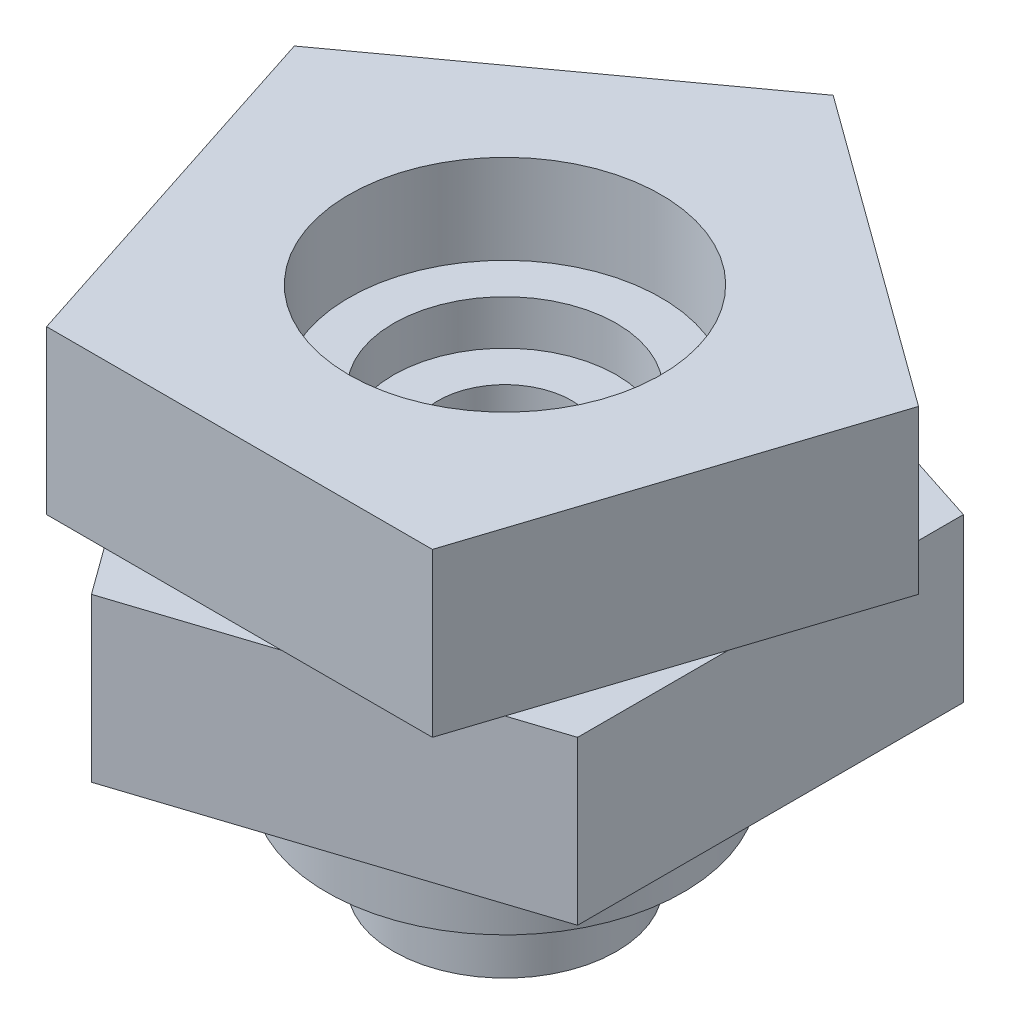
from build123d import *
from build123d.topology import SkipClean

# Parameters (mm, degrees)
EXTRUDE_1_DEPTH     = 3.65
EXTRUDE_2_DEPTH     = 3.65
SKETCH_3_R          = 3.5
CUT_EXTRUDE_1_DEPTH = 2
SKETCH_4_R          = 4
EXTRUDE_3_DEPTH     = 2.5
CUT_EXTRUDE_2_DEPTH = 15.296125349
SKETCH_7_R          = 2.5
CUT_EXTRUDE_3_DEPTH = 1
SKETCH_8_R          = 2.5
EXTRUDE_4_DEPTH     = 1.9


with BuildPart() as part:
    # 草图1 → 凸台-拉伸1 (new body)
    with BuildSketch(Plane(origin=(0, 0, 0), x_dir=(1, 0, 0), z_dir=(0, 1, 0))):
        Polygon((0, 7.36), (-6.99977596, 2.274365079), (-4.326099457, -5.954365079), (4.326099457, -5.954365079), (6.99977596, 2.274365079), align=None)
    extrude(amount=EXTRUDE_1_DEPTH)

    # 草图2 → 凸台-拉伸2 (add)
    with BuildSketch(Plane(origin=(0, 0, 0), x_dir=(1, 0, 0), z_dir=(0, 1, 0))):
        Polygon((-2.274365079, -6.99977596), (5.954365079, -4.326099457), (5.954365079, 4.326099457), (-2.274365079, 6.99977596), (-7.36, 0), align=None)
    extrude(amount=-EXTRUDE_2_DEPTH)

    # 草图3 → 切除-拉伸1 (cut)
    with BuildSketch(Plane(origin=(0, 3.65, 0), x_dir=(1, 0, 0), z_dir=(0, 1, 0))):
        with Locations(Location((0, 0, 0), (0, 0, 270))):
            Circle(SKETCH_3_R)
    extrude(amount=-CUT_EXTRUDE_1_DEPTH, mode=Mode.SUBTRACT)

    # 草图4 → 凸台-拉伸3 (add)
    with BuildSketch(Plane.XZ.offset(3.65)):
        with Locations(Location((0, 0, 0), (0, 0, 270))):
            Circle(SKETCH_4_R)
    extrude(amount=EXTRUDE_3_DEPTH)

    # 草图6 → 切除-拉伸2 (cut, through all)
    with BuildSketch(Plane.XZ.offset(6.15)):
        with BuildLine():
            Line((-1.299038106, 0.75), (1.299038106, 0.75))
            ThreePointArc((1.299038106, 0.75), (0, -1.5), (-1.299038106, 0.75))
        make_face()
    extrude(amount=-CUT_EXTRUDE_2_DEPTH, mode=Mode.SUBTRACT)

    # 草图7 → 切除-拉伸3 (cut)
    with BuildSketch(Plane(origin=(0, 1.65, 0), x_dir=(1, 0, 0), z_dir=(0, 1, 0))):
        with Locations(Location((0, 0, 0), (0, 0, 270))):
            Circle(SKETCH_7_R)
    extrude(amount=-CUT_EXTRUDE_3_DEPTH, mode=Mode.SUBTRACT)

    # 草图8 → 凸台-拉伸4 (add)
    with SkipClean():  # the faces are left unmerged after this step: merging them gives an invalid solid
        with BuildSketch(Plane.XZ.offset(6.15)):
            with Locations(Location((0, 0, 0), (0, 0, 90))):
                Circle(SKETCH_8_R)
            with BuildLine():
                Line((1.299038106, 0.75), (-1.299038106, 0.75))
                ThreePointArc((-1.299038106, 0.75), (0, -1.5), (1.299038106, 0.75))
            make_face(mode=Mode.SUBTRACT)
        extrude(amount=EXTRUDE_4_DEPTH)


solid = part.part
